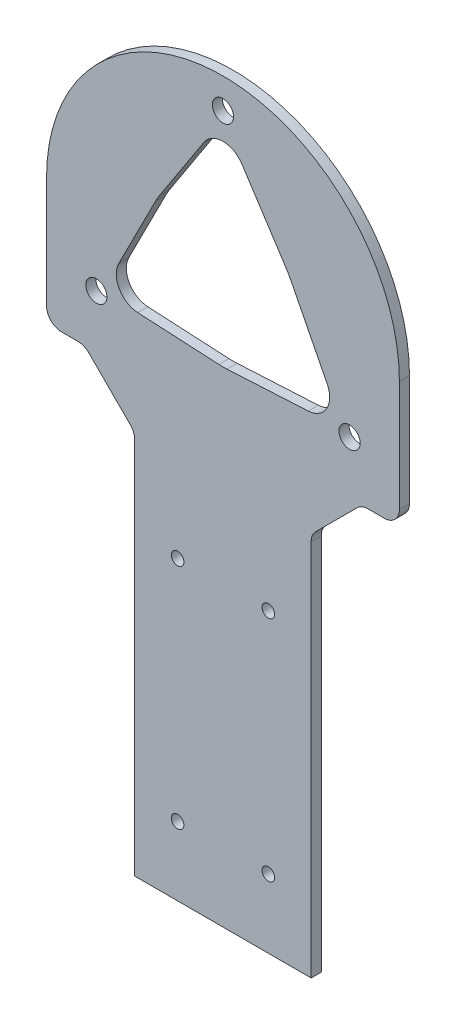
from build123d import *

# Parameters (mm, degrees)
SKETCH_1_R          = 2.1
EXTRUDE_1_DEPTH     = 2
SKETCH_2_W          = 35
SKETCH_2_H          = 2
EXTRUDE_2_DEPTH     = 30
SKETCH_4_W          = 35
SKETCH_4_H          = 3
CUT_EXTRUDE_2_DEPTH = 10
SKETCH_5_R          = 1.25
CUT_EXTRUDE_3_DEPTH = 10


with BuildPart() as part:
    # 草图1 → 凸台-拉伸1 (new body)
    with BuildSketch(Plane.XY):
        with BuildLine():
            Line((-33.941138155, 25.010321846), (-33.941138155, 3.010321846))
            ThreePointArc((-33.941138155, 3.010321846), (-33.062458498, 0.889001502), (-30.941138155, 0.010321846))
            Line((-30.941138155, 0.010321846), (-27.683778842, 0.010321846))
            ThreePointArc((-27.683778842, 0.010321846), (-26.535728545, -0.218039556), (-25.562458498, -0.86835781))
            Line((-25.562458498, -0.86835781), (-17.319817811, -9.110998498))
            ThreePointArc((-17.319817811, -9.110998498), (-16.669499557, -10.084268544), (-16.441138155, -11.232318841))
            Line((-16.441138155, -11.232318841), (-16.441138155, -59.216175462))
            Line((-16.441138155, -59.216175462), (18.558861845, -59.216175462))
            Line((18.558861845, -59.216175462), (18.558861845, -11.232318841))
            ThreePointArc((18.558861845, -11.232318841), (18.787223248, -10.084268544), (19.437541502, -9.110998498))
            Line((19.437541502, -9.110998498), (27.680182189, -0.86835781))
            ThreePointArc((27.680182189, -0.86835781), (28.653452235, -0.218039556), (29.801502532, 0.010321846))
            Line((29.801502532, 0.010321846), (33.058861845, 0.010321846))
            ThreePointArc((33.058861845, 0.010321846), (35.180182189, 0.889001502), (36.058861845, 3.010321846))
            Line((36.058861845, 3.010321846), (36.058861845, 25.010321846))
            ThreePointArc((36.058861845, 25.010321846), (1.058861845, 60.010321846), (-33.941138155, 25.010321846))
        make_face()
        with Locations((26.173598555, 10.510321846)):
            Circle(SKETCH_1_R, mode=Mode.SUBTRACT)
        with Locations((-24.055874865, 10.510321846)):
            Circle(SKETCH_1_R, mode=Mode.SUBTRACT)
        with Locations((1.058861845, 54.010321846)):
            Circle(SKETCH_1_R, mode=Mode.SUBTRACT)
        with BuildLine():
            Line((13.630967923, 33.192140028), (4.830493669, 46.714867301))
            ThreePointArc((4.830493669, 46.714867301), (1.058861845, 48.760321846), (-2.712769978, 46.714867301))
            Line((-2.712769978, 46.714867301), (-11.513244233, 33.192140028))
            ThreePointArc((-11.513244233, 33.192140028), (-11.931519212, 32.510321846), (-12.312853589, 31.807175998))
            Line((-12.312853589, 31.807175998), (-19.623641808, 17.424378092))
            ThreePointArc((-19.623641808, 17.424378092), (-19.509241495, 13.135321846), (-15.852009984, 10.891720146))
            Line((-15.852009984, 10.891720146), (0.25925249, 10.031649512))
            ThreePointArc((0.25925249, 10.031649512), (1.058861845, 10.010321846), (1.858471201, 10.031649512))
            Line((1.858471201, 10.031649512), (17.969733675, 10.891720146))
            ThreePointArc((17.969733675, 10.891720146), (21.626965185, 13.135321846), (21.741365498, 17.424378092))
            Line((21.741365498, 17.424378092), (14.430577279, 31.807175998))
            ThreePointArc((14.430577279, 31.807175998), (14.049242902, 32.510321846), (13.630967923, 33.192140028))
        make_face(mode=Mode.SUBTRACT)
    extrude(amount=EXTRUDE_1_DEPTH)

    # 草图2 → 凸台-拉伸2 (add)
    with BuildSketch(Plane.XZ.offset(59.216175462)):
        with Locations((1.058861845, 1)):
            Rectangle(SKETCH_2_W, SKETCH_2_H)
    extrude(amount=EXTRUDE_2_DEPTH)

    # 草图4 → 切除-拉伸2 (cut)
    with BuildSketch(Plane.XY.offset(2)):
        with Locations((1.058861845, -87.716175462)):
            Rectangle(SKETCH_4_W, SKETCH_4_H)
    extrude(amount=-CUT_EXTRUDE_2_DEPTH, mode=Mode.SUBTRACT)

    # 草图5 → 切除-拉伸3 (cut)
    with BuildSketch(Plane.XY.offset(2)):
        with Locations((10.058861845, -27.388786859)):
            Circle(SKETCH_5_R)
        with Locations((-7.941138155, -27.388786859)):
            Circle(SKETCH_5_R)
        with Locations((-7.941138155, -72.588786859)):
            Circle(SKETCH_5_R)
        with Locations((10.058861845, -72.588786859)):
            Circle(SKETCH_5_R)
    extrude(amount=-CUT_EXTRUDE_3_DEPTH, mode=Mode.SUBTRACT)


solid = part.part
